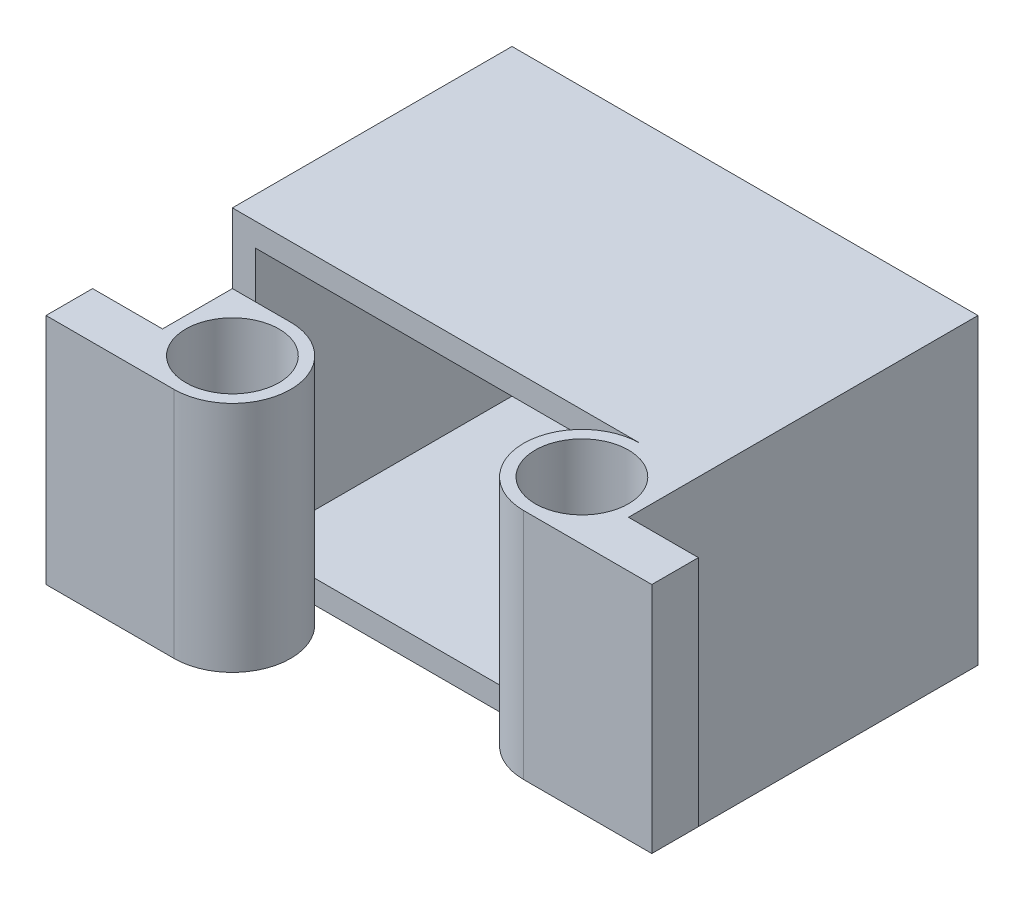
from build123d import *

# Parameters (mm, degrees)
SKETCH_1_W          = 20
SKETCH_1_H          = 13
EXTRUDE_1_DEPTH     = 12
SHELL_1_T           = -1
SKETCH_2_R          = 2.5
SKETCH_2_R_2        = 2
EXTRUDE_4_DEPTH     = 10
SKETCH_3_R          = 4.9
CUT_EXTRUDE_1_DEPTH = 0.2
SKETCH_9_R          = 2.5
SKETCH_9_R_2        = 2
EXTRUDE_8_DEPTH     = 10
SKETCH_6_W          = 2
SKETCH_6_H          = 10
EXTRUDE_10_DEPTH    = 3
SKETCH_10_W         = 2
SKETCH_10_H         = 10
EXTRUDE_11_DEPTH    = 3
SCALE_1_SCALE       = 2


with BuildPart() as part:
    # 스케치1 → 보스-돌출1 (new body)
    with BuildSketch(Plane.XY):
        Rectangle(SKETCH_1_W, SKETCH_1_H)
    extrude(amount=EXTRUDE_1_DEPTH)

    # 쉘1
    shell_1_openings = [part.faces().sort_by_distance(p)[0] for p in [
        (0, 0, 12),
    ]]
    offset(amount=SHELL_1_T, openings=shell_1_openings, kind=Kind.INTERSECTION)

    # 스케치3 → 컷-돌출1 (cut)
    with BuildSketch(Plane.XY.offset(1)):
        Circle(SKETCH_3_R)
    extrude(amount=-CUT_EXTRUDE_1_DEPTH, mode=Mode.SUBTRACT)

    # 스케치9 → 보스-돌출8 (add)
    # profile 1 of 3: a face of its own
    with BuildSketch(Plane(origin=(0, 6.5, 0), x_dir=(1, 0, 0), z_dir=(0, 1, 0))):
        with BuildLine():
            Line((10, -14.5), (10, -12))
            Line((10, -12), (7.5, -12))
            ThreePointArc((7.5, -12), (9.267766953, -12.732233047), (10, -14.5))
        make_face()
    # profile 2 of 3: a face of its own
    with BuildSketch(Plane(origin=(0, 6.5, 0), x_dir=(1, 0, 0), z_dir=(0, 1, 0))):
        with BuildLine():
            Line((10, -17), (10, -14.5))
            ThreePointArc((10, -14.5), (9.267766953, -16.267766953), (7.5, -17))
            Line((7.5, -17), (10, -17))
        make_face()
    # profile 3 of 3: a face of its own
    with BuildSketch(Plane(origin=(0, 6.5, 0), x_dir=(1, 0, 0), z_dir=(0, 1, 0))):
        with Locations((7.5, -14.5)):
            Circle(SKETCH_9_R)
        with Locations(Location((7.5, -14.5, 0), (0, 0, 270))):
            Circle(SKETCH_9_R_2, mode=Mode.SUBTRACT)
    extrude(amount=-EXTRUDE_8_DEPTH)


with BuildPart() as body_2:
    # 스케치2 → 보스-돌출4 (new body)
    # profile 1 of 3: a face of its own
    with BuildSketch(Plane(origin=(0, 3.5, 0), x_dir=(1, 0, 0), z_dir=(0, 1, 0))):
        with BuildLine():
            ThreePointArc((-7.5, -17), (-9.267766953, -16.267766953), (-10, -14.5))
            Line((-10, -14.5), (-10, -17))
            Line((-10, -17), (-7.5, -17))
        make_face()
    # profile 2 of 3: a face of its own
    with BuildSketch(Plane(origin=(0, 3.5, 0), x_dir=(1, 0, 0), z_dir=(0, 1, 0))):
        with Locations((-7.5, -14.5)):
            Circle(SKETCH_2_R)
        with Locations(Location((-7.5, -14.5, 0), (0, 0, 270))):
            Circle(SKETCH_2_R_2, mode=Mode.SUBTRACT)
    # profile 3 of 3: a face of its own
    with BuildSketch(Plane(origin=(0, 3.5, 0), x_dir=(1, 0, 0), z_dir=(0, 1, 0))):
        with BuildLine():
            Line((-7.5, -12), (-10, -12))
            Line((-10, -12), (-10, -14.5))
            ThreePointArc((-10, -14.5), (-9.267766953, -12.732233047), (-7.5, -12))
        make_face()
    extrude(amount=-EXTRUDE_4_DEPTH)


    add(part.part)  # 보스-돌출10 merges part
    # 스케치6 → 보스-돌출10 (add)
    with BuildSketch(Plane.ZY.offset(10)):
        with Locations((16, -1.5)):
            Rectangle(SKETCH_6_W, SKETCH_6_H)
    extrude(amount=EXTRUDE_10_DEPTH)

    # 스케치10 → 보스-돌출11 (add)
    with BuildSketch(Plane(origin=(10, 0, 0), x_dir=(0, 0, -1), z_dir=(1, 0, 0))):
        with Locations((-16, 1.5)):
            Rectangle(SKETCH_10_W, SKETCH_10_H)
    extrude(amount=EXTRUDE_11_DEPTH)


with BuildPart() as body_2_1:
    # 축척1: scaled about (0, 0, 0)
    add(body_2.part.scale(SCALE_1_SCALE))


solid = body_2_1.part
